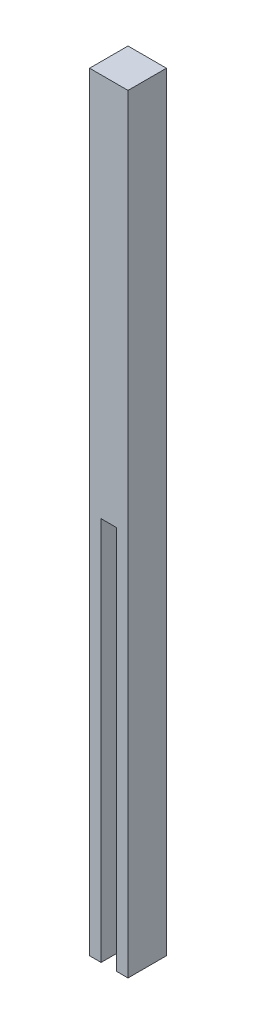
from build123d import *

# Parameters (mm, degrees)
SKETCH1_W           = 100
SKETCH1_H           = 100
BOSS_EXTRUDE1_DEPTH = 2000
SKETCH2_W           = 40
SKETCH2_H           = 1000
CUT_EXTRUDE1_DEPTH  = 40


with BuildPart() as part:
    # Sketch1 → Boss-Extrude1 (new body)
    with BuildSketch(Plane(origin=(0, 0, 0), x_dir=(1, 0, 0), z_dir=(0, 1, 0))):
        with Locations((6.50810977, -17.305559975)):
            Rectangle(SKETCH1_W, SKETCH1_H)
    extrude(amount=BOSS_EXTRUDE1_DEPTH)

    # Sketch2 → Cut-Extrude1 (cut)
    with BuildSketch(Plane.XY.offset(67.305559975)):
        with Locations((6.50810977, 500)):
            Rectangle(SKETCH2_W, SKETCH2_H)
    extrude(amount=-CUT_EXTRUDE1_DEPTH, mode=Mode.SUBTRACT)


solid = part.part
